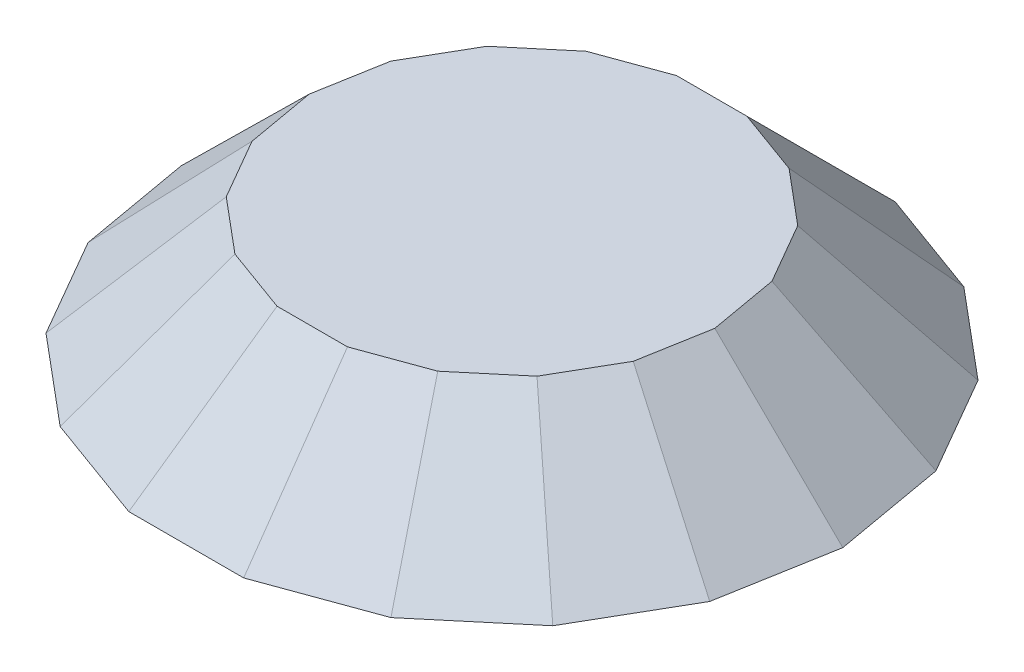
from build123d import *

# Parameters (mm, degrees)
BOSS_EXTRUDE2_DEPTH = 40
BOSS_EXTRUDE2_TAPER = 45
SHELL1_T            = -2


with BuildPart() as part:
    # Sketch1 → Boss-Extrude2 (new body)
    with BuildSketch(Plane(origin=(0, 0, 0), x_dir=(1, 0, 0), z_dir=(0, 1, 0))):
        Polygon((105, 0), (98.667725183, 35.912115049), (80.434666527, 67.492699017), (52.5, 90.932667397), (18.233058655, 103.404814066), (-18.233058655, 103.404814066), (-52.5, 90.932667397), (-80.434666527, 67.492699017), (-98.667725183, 35.912115049), (-105, 0), (-98.667725183, -35.912115049), (-80.434666527, -67.492699017), (-52.5, -90.932667397), (-18.233058655, -103.404814066), (18.233058655, -103.404814066), (52.5, -90.932667397), (80.434666527, -67.492699017), (98.667725183, -35.912115049), align=None)
    extrude(amount=BOSS_EXTRUDE2_DEPTH, taper=BOSS_EXTRUDE2_TAPER)

    # Shell1
    shell1_openings = [part.faces().sort_by_distance(p)[0] for p in [
        (0, 0, 0),
    ]]
    offset(amount=SHELL1_T, openings=shell1_openings, kind=Kind.INTERSECTION)


solid = part.part
